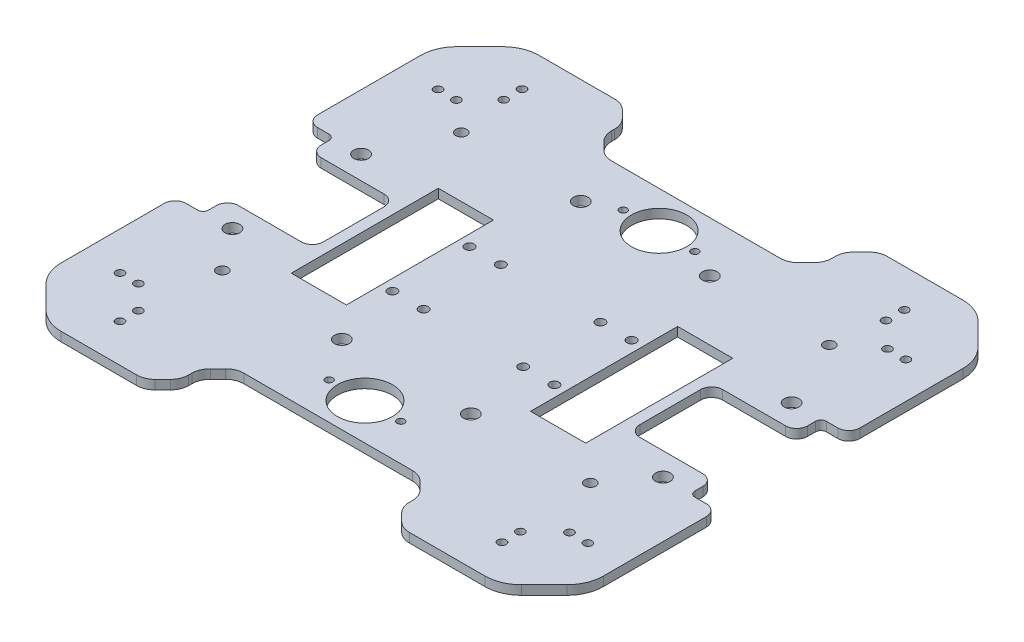
from build123d import *

# Parameters (mm, degrees)
SKETCH2_W                                     = 30
SKETCH2_H                                     = 80
BASE_DEPTH                                    = 5
SKETCH3_R                                     = 4
ENCODER_MOUNTING_ORIGINAL_BR_DEPTH            = 5
ENCODER_MOUNTING_SYM_XL_COPY_1_SKETCH_R       = 4
ENCODER_MOUNTING_SYM_XL_COPY_1_DEPTH          = 5
SKETCH4_R                                     = 2.5
WHEEL_GUIDES_MOUNTING_ORIGINAL_XR_DEPTH       = 5
SKETCH6_R                                     = 3
FRAME_MOUNTING_DEPTH                          = 5
SKETCH5_R                                     = 4
SUPPORT_MOTEUR_MOUNTING_INSIDE_ORIGINAL_DEPTH = 5
SKETCH13_R                                    = 15
SKETCH13_R_2                                  = 2
SCROLLERS_MOUNTINGS_DEPTH                     = 5
CHAMFER1_SIZE                                 = 24
FILLET1_R                                     = 20
ESQUISSE1_W                                   = 120
ESQUISSE1_H                                   = 30
ENL_V_MAT_EXTRU_1_DEPTH                       = 197.675494152
CHANFREIN1_SIZE                               = 10
CONG_1_R                                      = 10
CHANFREIN2_SIZE                               = 10
CONG_2_R                                      = 10
ESQUISSE2_R                                   = 2.25
ENL_V_MAT_EXTRU_2_DEPTH                       = 197.675494152
ESQUISSE3_R                                   = 2.25
ENL_V_MAT_EXTRU_3_DEPTH                       = 197.675494152
ESQUISSE4_R                                   = 2.25
ENL_V_MAT_EXTRU_4_DEPTH                       = 197.675494152
ESQUISSE5_R                                   = 2.25
ENL_V_MAT_EXTRU_5_DEPTH                       = 197.675494152


with BuildPart() as part:
    # Sketch2 → Base (new body)
    with BuildSketch(Plane(origin=(0, 0, 0), x_dir=(1, 0, 0), z_dir=(0, 1, 0))):
        with BuildLine():
            Line((-147.5, -130), (147.5, -130))
            Line((147.5, -130), (147.5, -41.75500004))
            ThreePointArc((147.5, -41.75500004), (145.742640687, -37.512359353), (141.5, -35.75500004))
            Line((141.5, -35.75500004), (135.3, -35.75500004))
            ThreePointArc((135.3, -35.75500004), (133.178679656, -34.876320383), (132.3, -32.75500004))
            Line((132.3, -32.75500004), (132.3, -28.530608474))
            ThreePointArc((132.3, -28.530608474), (130.542640675, -24.287967759), (126.29999996, -22.530608435))
            Line((126.29999996, -22.530608435), (92.090541187, -22.530608435))
            ThreePointArc((92.090541187, -22.530608435), (87.8479005, -20.773249122), (86.090541187, -16.530608435))
            Line((86.090541187, -16.530608435), (86.090541187, 16.530608435))
            ThreePointArc((86.090541187, 16.530608435), (87.8479005, 20.773249122), (92.090541187, 22.530608435))
            Line((92.090541187, 22.530608435), (126.29999996, 22.530608435))
            ThreePointArc((126.29999996, 22.530608435), (130.542640675, 24.287967759), (132.3, 28.530608474))
            Line((132.3, 28.530608474), (132.3, 32.75500004))
            ThreePointArc((132.3, 32.75500004), (133.178679656, 34.876320383), (135.3, 35.75500004))
            Line((135.3, 35.75500004), (141.5, 35.75500004))
            ThreePointArc((141.5, 35.75500004), (145.742640687, 37.512359353), (147.5, 41.75500004))
            Line((147.5, 41.75500004), (147.5, 130))
            Line((147.5, 130), (-147.5, 130))
            Line((-147.5, 130), (-147.5, 41.75500004))
            ThreePointArc((-147.5, 41.75500004), (-145.742640687, 37.512359353), (-141.5, 35.75500004))
            Line((-141.5, 35.75500004), (-135.3, 35.75500004))
            ThreePointArc((-135.3, 35.75500004), (-133.178679656, 34.876320383), (-132.3, 32.75500004))
            Line((-132.3, 32.75500004), (-132.3, 28.530608474))
            ThreePointArc((-132.3, 28.530608474), (-130.542640675, 24.287967759), (-126.29999996, 22.530608435))
            Line((-126.29999996, 22.530608435), (-92.090541187, 22.530608435))
            ThreePointArc((-92.090541187, 22.530608435), (-87.8479005, 20.773249122), (-86.090541187, 16.530608435))
            Line((-86.090541187, 16.530608435), (-86.090541187, -16.530608435))
            ThreePointArc((-86.090541187, -16.530608435), (-87.8479005, -20.773249122), (-92.090541187, -22.530608435))
            Line((-92.090541187, -22.530608435), (-126.29999996, -22.530608435))
            ThreePointArc((-126.29999996, -22.530608435), (-130.542640675, -24.287967759), (-132.3, -28.530608474))
            Line((-132.3, -28.530608474), (-132.3, -32.75500004))
            ThreePointArc((-132.3, -32.75500004), (-133.178679656, -34.876320383), (-135.3, -35.75500004))
            Line((-135.3, -35.75500004), (-141.5, -35.75500004))
            ThreePointArc((-141.5, -35.75500004), (-145.742640687, -37.512359353), (-147.5, -41.75500004))
            Line((-147.5, -41.75500004), (-147.5, -130))
        make_face()
        with Locations((65.090541187, 0)):
            Rectangle(SKETCH2_W, SKETCH2_H, mode=Mode.SUBTRACT)
        with Locations((-65.090541187, 0)):
            Rectangle(SKETCH2_W, SKETCH2_H, mode=Mode.SUBTRACT)
    extrude(amount=BASE_DEPTH)

    # Sketch3 → Encoder Mounting-Original_BR (cut)
    with BuildSketch(Plane(origin=(0, 5, 0), x_dir=(1, 0, 0), z_dir=(0, 1, 0))):
        with Locations(Location((117.1, -35.000608435, 0), (0, 0, 270))):
            Circle(SKETCH3_R)
    encoder_mounting_original_br = extrude(amount=-ENCODER_MOUNTING_ORIGINAL_BR_DEPTH, mode=Mode.SUBTRACT)

    # Encoder Mounting-Sym_FR: Encoder Mounting-Original_BR across plane
    add(encoder_mounting_original_br.mirror(Plane(origin=(0, 0, 0), x_dir=(1, 0, 0), z_dir=(0, 0, -1))), mode=Mode.SUBTRACT)

    # Encoder Mounting-Sym_xL: Encoder Mounting-Original_BR across plane
    add(encoder_mounting_original_br.mirror(Plane(origin=(0, 0, 0), x_dir=(0, 0, 1), z_dir=(1, 0, 0))), mode=Mode.SUBTRACT)

    # Encoder Mounting-Sym_xL copy 1 sketch → Encoder Mounting-Sym_xL copy 1 (cut)
    with BuildSketch(Plane(origin=(0, 5, 0), x_dir=(-1, 0, 0), z_dir=(0, 1, 0))):
        with Locations(Location((117.1, -35.000608435, 0), (0, 0, 270))):
            Circle(ENCODER_MOUNTING_SYM_XL_COPY_1_SKETCH_R)
    extrude(amount=-ENCODER_MOUNTING_SYM_XL_COPY_1_DEPTH, mode=Mode.SUBTRACT)

    # Sketch4 → Wheel Guides Mounting-Original_xR (cut)
    with BuildSketch(Plane(origin=(0, 5, 0), x_dir=(1, 0, 0), z_dir=(0, 1, 0))):
        with Locations(Location((44.090541187, -21, 0), (0, 0, 270))):
            Circle(SKETCH4_R)
        with Locations(Location((27.090541187, -21, 0), (0, 0, 270))):
            Circle(SKETCH4_R)
        with Locations(Location((27.090541187, 21, 0), (0, 0, 270))):
            Circle(SKETCH4_R)
        with Locations(Location((44.090541187, 21, 0), (0, 0, 270))):
            Circle(SKETCH4_R)
    wheel_guides_mounting_original_xr = extrude(amount=-WHEEL_GUIDES_MOUNTING_ORIGINAL_XR_DEPTH, mode=Mode.SUBTRACT)

    # Wheel Guides Mounting-Sym_xL: Wheel Guides Mounting-Original_xR across plane
    add(wheel_guides_mounting_original_xr.mirror(Plane(origin=(0, 0, 0), x_dir=(0, 0, 1), z_dir=(1, 0, 0))), mode=Mode.SUBTRACT)

    # Sketch6 → Frame Mounting (cut)
    with BuildSketch(Plane(origin=(0, 5, 0), x_dir=(1, 0, 0), z_dir=(0, 1, 0))):
        with Locations(Location((100.090541187, -57.469391565, 0), (0, 0, 270))):
            Circle(SKETCH6_R)
        with Locations(Location((-100.090541187, -57.469391565, 0), (0, 0, 270))):
            Circle(SKETCH6_R)
        with Locations(Location((100.090541187, 72.530608435, 0), (0, 0, 270))):
            Circle(SKETCH6_R)
        with Locations(Location((-100.090541187, 72.530608435, 0), (0, 0, 270))):
            Circle(SKETCH6_R)
    extrude(amount=-FRAME_MOUNTING_DEPTH, mode=Mode.SUBTRACT)

    # Sketch5 → Support Moteur Mounting Inside-Original_xR (cut)
    with BuildSketch(Plane(origin=(0, 5, 0), x_dir=(1, 0, 0), z_dir=(0, 1, 0))):
        with Locations(Location((35.090541187, -57.469391565, 0), (0, 0, 270))):
            Circle(SKETCH5_R)
        with Locations(Location((35.090541187, 72.530608435, 0), (0, 0, 270))):
            Circle(SKETCH5_R)
    support_moteur_mounting_inside_original = extrude(amount=-SUPPORT_MOTEUR_MOUNTING_INSIDE_ORIGINAL_DEPTH, mode=Mode.SUBTRACT)

    # Support Moteur Mounting Inside-Sym_xL: Support Moteur Mounting Inside-Original_xR across plane
    add(support_moteur_mounting_inside_original.mirror(Plane(origin=(0, 0, 0), x_dir=(0, 0, 1), z_dir=(1, 0, 0))), mode=Mode.SUBTRACT)

    # Sketch13 → Scrollers Mountings (cut)
    with BuildSketch(Plane(origin=(0, 5, 0), x_dir=(1, 0, 0), z_dir=(0, 1, 0))):
        with Locations(Location((0, -80, 0), (0, 0, 270))):
            Circle(SKETCH13_R)
        with Locations(Location((19.5, -80, 0), (0, 0, 270))):
            Circle(SKETCH13_R_2)
        with Locations(Location((-19.5, -80, 0), (0, 0, 270))):
            Circle(SKETCH13_R_2)
        with Locations(Location((0, 80, 0), (0, 0, 270))):
            Circle(SKETCH13_R)
        with Locations(Location((19.5, 80, 0), (0, 0, 270))):
            Circle(SKETCH13_R_2)
        with Locations(Location((-19.5, 80, 0), (0, 0, 270))):
            Circle(SKETCH13_R_2)
    extrude(amount=-SCROLLERS_MOUNTINGS_DEPTH, mode=Mode.SUBTRACT)

    # Chamfer1
    chamfer1_edges = [part.edges().sort_by_distance(p)[0] for p in [
        (147.5, 2.5, 130),
        (-147.5, 2.5, 130),
        (-147.5, 2.5, -130),
        (147.5, 2.5, -130),
    ]]
    chamfer(chamfer1_edges, length=CHAMFER1_SIZE)

    # Fillet1
    fillet1_edges = [part.edges().sort_by_distance(p)[0] for p in [
        (-123.5, 2.5, -130),
        (123.5, 2.5, -130),
        (147.5, 2.5, -106),
        (-147.5, 2.5, -106),
        (147.5, 2.5, 106),
        (-123.5, 2.5, 130),
        (123.5, 2.5, 130),
        (-147.5, 2.5, 106),
    ]]
    fillet(fillet1_edges, radius=FILLET1_R)

    # Esquisse1 → Enlèv. mat.-Extru.1 (cut, through all)
    with BuildSketch(Plane(origin=(0, 5, 0), x_dir=(1, 0, 0), z_dir=(0, 1, 0))):
        with Locations((0, 115)):
            Rectangle(ESQUISSE1_W, ESQUISSE1_H)
    enl_v_mat_extru_1 = extrude(amount=-ENL_V_MAT_EXTRU_1_DEPTH, mode=Mode.SUBTRACT)

    # Chanfrein1
    chanfrein1_edges = [part.edges().sort_by_distance(p)[0] for p in [
        (60, 2.5, -130),
        (60, 2.5, -100),
        (-60, 2.5, -100),
        (-60, 2.5, -130),
    ]]
    chamfer(chanfrein1_edges, length=CHANFREIN1_SIZE)

    # Congé1
    cong_1_edges = [part.edges().sort_by_distance(p)[0] for p in [
        (50, 2.5, -100),
        (-50, 2.5, -100),
        (-60, 2.5, -120),
        (-60, 2.5, -110),
        (60, 2.5, -120),
        (60, 2.5, -110),
        (-70, 2.5, -130),
        (70, 2.5, -130),
    ]]
    fillet(cong_1_edges, radius=CONG_1_R)

    # Symétrie1: Enlèv. mat.-Extru.1 across plane
    add(enl_v_mat_extru_1.mirror(Plane.XY), mode=Mode.SUBTRACT)

    # Chanfrein2
    chanfrein2_edges = [part.edges().sort_by_distance(p)[0] for p in [
        (60, 2.5, 100),
        (60, 2.5, 130),
        (-60, 2.5, 130),
        (-60, 2.5, 100),
    ]]
    chamfer(chanfrein2_edges, length=CHANFREIN2_SIZE)

    # Congé2
    cong_2_edges = [part.edges().sort_by_distance(p)[0] for p in [
        (-70, 2.5, 130),
        (-60, 2.5, 110),
        (-60, 2.5, 120),
        (50, 2.5, 100),
        (-50, 2.5, 100),
        (60, 2.5, 120),
        (60, 2.5, 110),
        (70, 2.5, 130),
    ]]
    fillet(cong_2_edges, radius=CONG_2_R)

    # Esquisse2 → Enlèv. mat.-Extru.2 (cut, through all)
    with BuildSketch(Plane(origin=(0, 5, 0), x_dir=(1, 0, 0), z_dir=(0, 1, 0))):
        with Locations(Location((117.75, 86.5, 0), (0, 0, 270))):
            Circle(ESQUISSE2_R)
        with Locations(Location((127.75, 86.5, 0), (0, 0, 270))):
            Circle(ESQUISSE2_R)
    enl_v_mat_extru_2 = extrude(amount=-ENL_V_MAT_EXTRU_2_DEPTH, mode=Mode.SUBTRACT)

    # Esquisse3 → Enlèv. mat.-Extru.3 (cut, through all)
    with BuildSketch(Plane(origin=(0, 5, 0), x_dir=(1, 0, 0), z_dir=(0, 1, 0))):
        with Locations(Location((104, 109.45, 0), (0, 0, 270))):
            Circle(ESQUISSE3_R)
        with Locations(Location((104, 99.45, 0), (0, 0, 270))):
            Circle(ESQUISSE3_R)
    enl_v_mat_extru_3 = extrude(amount=-ENL_V_MAT_EXTRU_3_DEPTH, mode=Mode.SUBTRACT)

    # Esquisse4 → Enlèv. mat.-Extru.4 (cut, through all)
    with BuildSketch(Plane(origin=(0, 5, 0), x_dir=(1, 0, 0), z_dir=(0, 1, 0))):
        with Locations(Location((-126.75, 86.5, 0), (0, 0, 270))):
            Circle(ESQUISSE4_R)
        with Locations(Location((-116.75, 86.5, 0), (0, 0, 270))):
            Circle(ESQUISSE4_R)
    enl_v_mat_extru_4 = extrude(amount=-ENL_V_MAT_EXTRU_4_DEPTH, mode=Mode.SUBTRACT)

    # Esquisse5 → Enlèv. mat.-Extru.5 (cut, through all)
    with BuildSketch(Plane(origin=(0, 5, 0), x_dir=(1, 0, 0), z_dir=(0, 1, 0))):
        with Locations(Location((-104, -99.25, 0), (0, 0, 270))):
            Circle(ESQUISSE5_R)
        with Locations(Location((-104, -109.25, 0), (0, 0, 270))):
            Circle(ESQUISSE5_R)
    extrude(amount=-ENL_V_MAT_EXTRU_5_DEPTH, mode=Mode.SUBTRACT)

    # Symétrie2: Enlèv. mat.-Extru.2, Enlèv. mat.-Extru.3 across plane
    add(enl_v_mat_extru_2.mirror(Plane.XY), mode=Mode.SUBTRACT)
    add(enl_v_mat_extru_3.mirror(Plane.XY), mode=Mode.SUBTRACT)

    # Symétrie3: Enlèv. mat.-Extru.3 across plane
    add(enl_v_mat_extru_3.mirror(Plane(origin=(0, 0, 0), x_dir=(0, 0, 1), z_dir=(1, 0, 0))), mode=Mode.SUBTRACT)

    # Symétrie4: Enlèv. mat.-Extru.4 across plane
    add(enl_v_mat_extru_4.mirror(Plane.XY), mode=Mode.SUBTRACT)


solid = part.part
